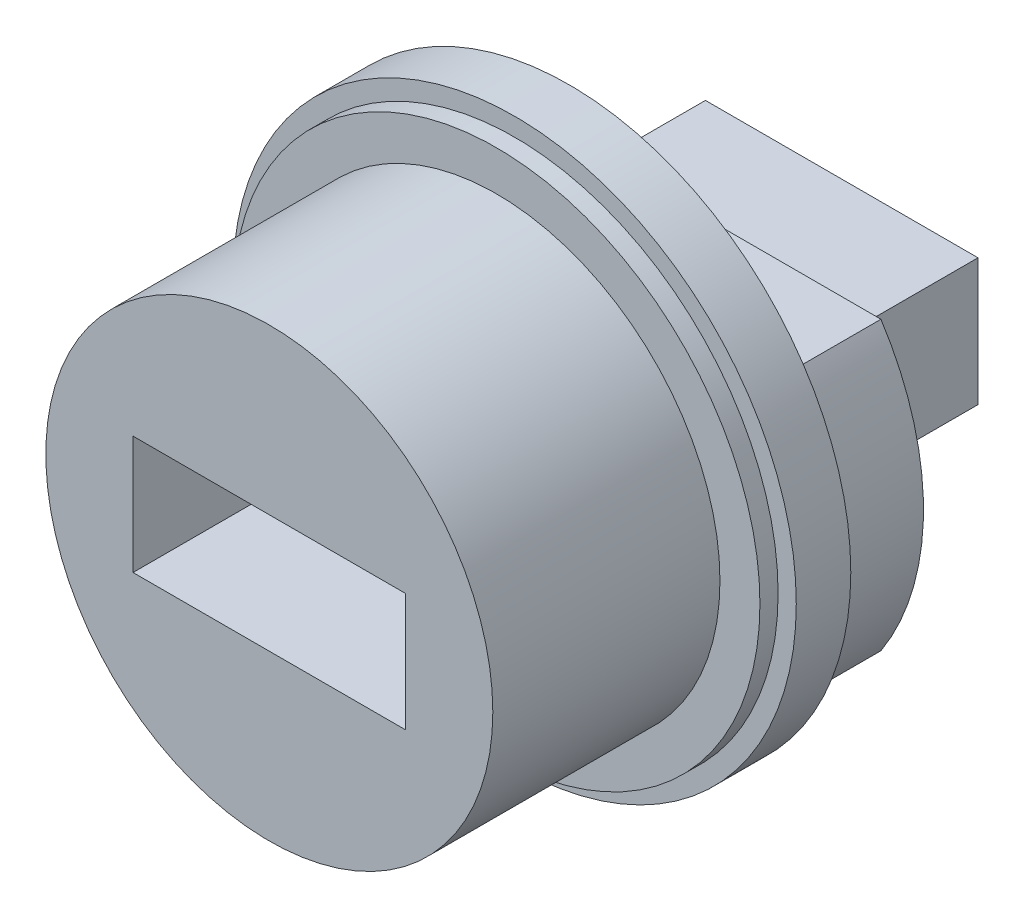
from build123d import *

# Parameters (mm, degrees)
SKETCH_1_R          = 15.5
EXTRUDE_1_DEPTH     = 3
SKETCH_2_R          = 14.5
EXTRUDE_2_DEPTH     = 1
SKETCH_3_R          = 12.3
EXTRUDE_3_DEPTH     = 12.5
SKETCH_4_W          = 15
SKETCH_4_H          = 6.5
CUT_EXTRUDE_1_DEPTH = 10
EXTRUDE_START       = 5
EXTRUDE_4_DEPTH     = 5
SKETCH_6_W          = 15
SKETCH_6_H          = 7
EXTRUDE_5_DEPTH     = 10


with BuildPart() as part:
    # ｽｹｯﾁ1 → ﾎﾞｽ - 押し出し1 (new body)
    with BuildSketch(Plane.XY):
        Circle(SKETCH_1_R)
    extrude(amount=EXTRUDE_1_DEPTH)

    # ｽｹｯﾁ2 → ﾎﾞｽ - 押し出し2 (add)
    with BuildSketch(Plane.XY.offset(3)):
        Circle(SKETCH_2_R)
    extrude(amount=EXTRUDE_2_DEPTH)

    # ｽｹｯﾁ3 → ﾎﾞｽ - 押し出し3 (add)
    with BuildSketch(Plane.XY.offset(4)):
        Circle(SKETCH_3_R)
    extrude(amount=EXTRUDE_3_DEPTH)

    # ｽｹｯﾁ4 → ｶｯﾄ - 押し出し1 (cut)
    with BuildSketch(Plane.XY.offset(16.5)):
        Rectangle(SKETCH_4_W, SKETCH_4_H)
    extrude(amount=-CUT_EXTRUDE_1_DEPTH, mode=Mode.SUBTRACT)

    # ｽｹｯﾁ5 → ﾎﾞｽ - 押し出し4 (add)
    with BuildSketch(Plane(origin=(0, 0, 0), x_dir=(-1, 0, 0), z_dir=(0, 0, -1)).offset(EXTRUDE_START)):
        with BuildLine():
            Line((-12.158947323, -7.9), (12.158947323, -7.9))
            ThreePointArc((12.158947323, -7.9), (14.5, 0), (12.158947323, 7.9))
            Line((12.158947323, 7.9), (-12.158947323, 7.9))
            ThreePointArc((-12.158947323, 7.9), (-14.5, 0), (-12.158947323, -7.9))
        make_face()
    extrude(amount=-EXTRUDE_4_DEPTH)

    # ｽｹｯﾁ6 → ﾎﾞｽ - 押し出し5 (add)
    with BuildSketch(Plane(origin=(0, 0, -5), x_dir=(-1, 0, 0), z_dir=(0, 0, -1))):
        Rectangle(SKETCH_6_W, SKETCH_6_H)
    extrude(amount=EXTRUDE_5_DEPTH)


solid = part.part
